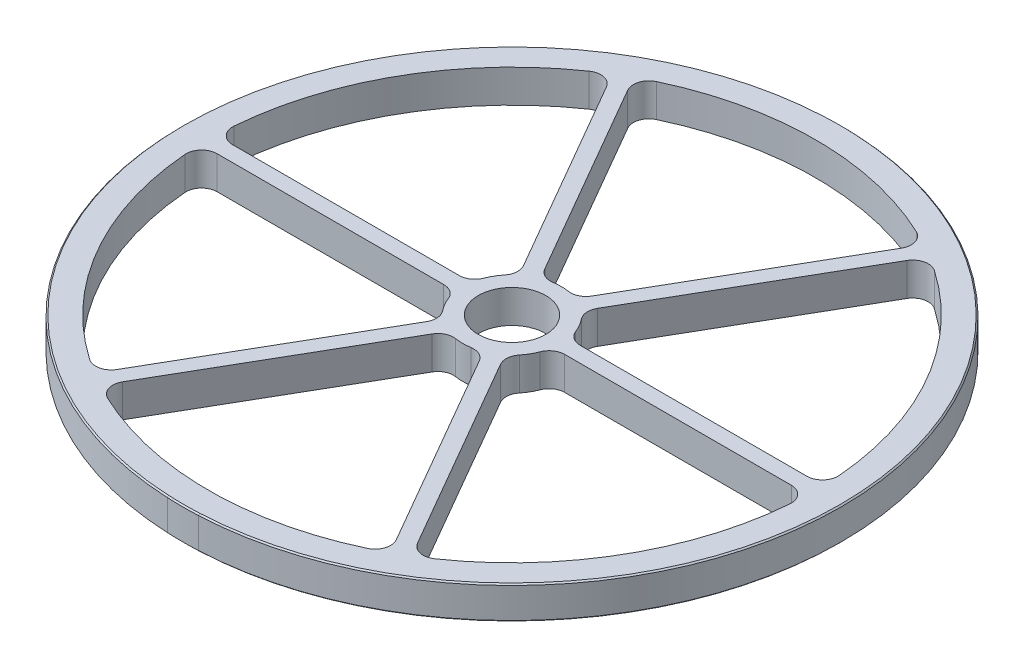
from build123d import *

# Parameters (mm, degrees)
SKETCH1_R           = 63.5
SKETCH1_R_2         = 6.5
BOSS_EXTRUDE3_DEPTH = 6.35
CHAMFER2_SIZE       = 0.25


with BuildPart() as part:
    # Sketch1 → Boss-Extrude3 (new body)
    with BuildSketch(Plane(origin=(0, 0, 0), x_dir=(1, 0, 0), z_dir=(0, 1, 0))):
        Circle(SKETCH1_R)
        Circle(SKETCH1_R_2, mode=Mode.SUBTRACT)
        with BuildLine():
            Line((-4.531913789, 10.849504938), (-26.359595266, 48.656158268))
            ThreePointArc((-26.359595266, 48.656158268), (-26.62540639, 51.049550304), (-25.04592549, 52.867301958))
            ThreePointArc((-25.04592549, 52.867301958), (0, 58.5), (25.04592549, 52.867301958))
            ThreePointArc((25.04592549, 52.867301958), (26.62540639, 51.049550304), (26.359595266, 48.656158268))
            Line((26.359595266, 48.656158268), (4.531913789, 10.849504938))
            ThreePointArc((4.531913789, 10.849504938), (3.227737969, 9.642879405), (1.469716559, 9.385623753))
            ThreePointArc((1.469716559, 9.385623753), (0, 9.5), (-1.469716559, 9.385623753))
            ThreePointArc((-1.469716559, 9.385623753), (-3.227737969, 9.642879405), (-4.531913789, 10.849504938))
        make_face(mode=Mode.SUBTRACT)
        with BuildLine():
            Line((7.129990001, 9.349504938), (28.957671478, 47.156158268))
            ThreePointArc((28.957671478, 47.156158268), (30.89750422, 48.583053472), (33.26146378, 48.124058715))
            ThreePointArc((33.26146378, 48.124058715), (50.662486121, 29.25), (58.30738927, 4.743243243))
            ThreePointArc((58.30738927, 4.743243243), (57.52291061, 2.466496832), (55.317266744, 1.5))
            Line((55.317266744, 1.5), (11.66190379, 1.5))
            ThreePointArc((11.66190379, 1.5), (9.964847515, 2.026136625), (8.86304688, 3.42))
            ThreePointArc((8.86304688, 3.42), (8.227241336, 4.75), (7.393330321, 5.965623753))
            ThreePointArc((7.393330321, 5.965623753), (6.737109546, 7.61674278), (7.129990001, 9.349504938))
        make_face(mode=Mode.SUBTRACT)
        with BuildLine():
            Line((11.66190379, -1.5), (55.317266744, -1.5))
            ThreePointArc((55.317266744, -1.5), (57.52291061, -2.466496832), (58.30738927, -4.743243243))
            ThreePointArc((58.30738927, -4.743243243), (50.662486121, -29.25), (33.26146378, -48.124058715))
            ThreePointArc((33.26146378, -48.124058715), (30.89750422, -48.583053472), (28.957671478, -47.156158268))
            Line((28.957671478, -47.156158268), (7.129990001, -9.349504938))
            ThreePointArc((7.129990001, -9.349504938), (6.737109546, -7.61674278), (7.393330321, -5.965623753))
            ThreePointArc((7.393330321, -5.965623753), (8.227241336, -4.75), (8.86304688, -3.42))
            ThreePointArc((8.86304688, -3.42), (9.964847515, -2.026136625), (11.66190379, -1.5))
        make_face(mode=Mode.SUBTRACT)
        with BuildLine():
            Line((4.531913789, -10.849504938), (26.359595266, -48.656158268))
            ThreePointArc((26.359595266, -48.656158268), (26.62540639, -51.049550304), (25.04592549, -52.867301958))
            ThreePointArc((25.04592549, -52.867301958), (0, -58.5), (-25.04592549, -52.867301958))
            ThreePointArc((-25.04592549, -52.867301958), (-26.62540639, -51.049550304), (-26.359595266, -48.656158268))
            Line((-26.359595266, -48.656158268), (-4.531913789, -10.849504938))
            ThreePointArc((-4.531913789, -10.849504938), (-3.227737969, -9.642879405), (-1.469716559, -9.385623753))
            ThreePointArc((-1.469716559, -9.385623753), (0, -9.5), (1.469716559, -9.385623753))
            ThreePointArc((1.469716559, -9.385623753), (3.227737969, -9.642879405), (4.531913789, -10.849504938))
        make_face(mode=Mode.SUBTRACT)
        with BuildLine():
            Line((-7.129990001, -9.349504938), (-28.957671478, -47.156158268))
            ThreePointArc((-28.957671478, -47.156158268), (-30.89750422, -48.583053472), (-33.26146378, -48.124058715))
            ThreePointArc((-33.26146378, -48.124058715), (-50.662486121, -29.25), (-58.30738927, -4.743243243))
            ThreePointArc((-58.30738927, -4.743243243), (-57.52291061, -2.466496832), (-55.317266744, -1.5))
            Line((-55.317266744, -1.5), (-11.66190379, -1.5))
            ThreePointArc((-11.66190379, -1.5), (-9.964847515, -2.026136625), (-8.86304688, -3.42))
            ThreePointArc((-8.86304688, -3.42), (-8.227241336, -4.75), (-7.393330321, -5.965623753))
            ThreePointArc((-7.393330321, -5.965623753), (-6.737109546, -7.61674278), (-7.129990001, -9.349504938))
        make_face(mode=Mode.SUBTRACT)
        with BuildLine():
            Line((-11.66190379, 1.5), (-55.317266744, 1.5))
            ThreePointArc((-55.317266744, 1.5), (-57.52291061, 2.466496832), (-58.30738927, 4.743243243))
            ThreePointArc((-58.30738927, 4.743243243), (-50.662486121, 29.25), (-33.26146378, 48.124058715))
            ThreePointArc((-33.26146378, 48.124058715), (-30.89750422, 48.583053472), (-28.957671478, 47.156158268))
            Line((-28.957671478, 47.156158268), (-7.129990001, 9.349504938))
            ThreePointArc((-7.129990001, 9.349504938), (-6.737109546, 7.61674278), (-7.393330321, 5.965623753))
            ThreePointArc((-7.393330321, 5.965623753), (-8.227241336, 4.75), (-8.86304688, 3.42))
            ThreePointArc((-8.86304688, 3.42), (-9.964847515, 2.026136625), (-11.66190379, 1.5))
        make_face(mode=Mode.SUBTRACT)
    extrude(amount=BOSS_EXTRUDE3_DEPTH)

    # Chamfer2
    chamfer2_edges = [part.edges().sort_by_distance(p)[0] for p in [
        (-63.5, 6.35, 0),
        (-63.5, 6.35, 0),
        (-63.5, 6.35, 0),
        (-63.5, 6.35, 0),
        (-63.5, 0, 0),
        (-63.5, 0, 0),
        (-63.5, 0, 0),
        (-63.5, 0, 0),
    ]]
    chamfer(chamfer2_edges, length=CHAMFER2_SIZE)


solid = part.part
